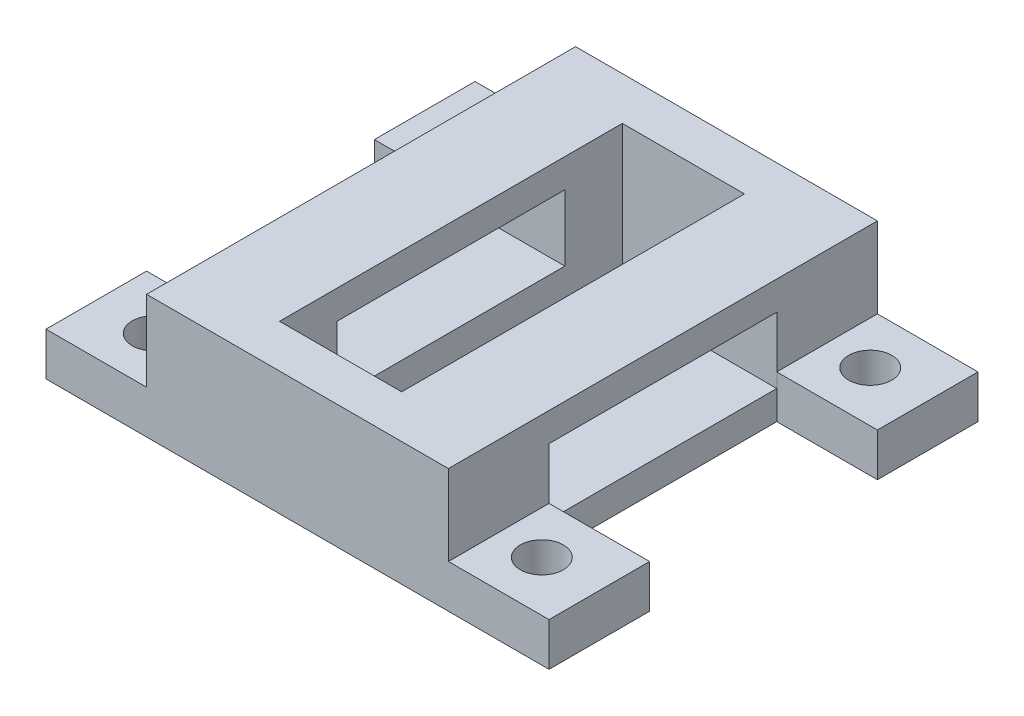
from build123d import *

# Parameters (mm, degrees)
BOSS_EXTRUDE1_DEPTH = 8.6
SKETCH5_W           = 8.5
SKETCH5_H           = 23.85
CUT_EXTRUDE3_DEPTH  = 10
SKETCH6_W           = 15.85
SKETCH6_H           = 4.6
CUT_EXTRUDE4_DEPTH  = 10
SKETCH7_W           = 15.85
SKETCH7_H           = 4.6
CUT_EXTRUDE5_DEPTH  = 10
SKETCH9_W           = 7
SKETCH9_H           = 7
BOSS_EXTRUDE3_DEPTH = 3
SKETCH10_R          = 1.5
CUT_EXTRUDE6_DEPTH  = 3


with BuildPart() as part:
    # Sketch1 → Boss-Extrude1 (new body)
    with BuildSketch(Plane(origin=(0, 0, 0), x_dir=(1, 0, 0), z_dir=(0, 1, 0))):
        Polygon((-10.5, 0), (-10.5, -24.849623113), (-10.5, -29.849623113), (7.5, -29.849623113), (10.5, -29.849623113), (10.5, -24.849623113), (10.5, 0), align=None)
    extrude(amount=BOSS_EXTRUDE1_DEPTH)

    # Sketch5 → Cut-Extrude3 (cut)
    with BuildSketch(Plane(origin=(0, 8.6, 0), x_dir=(1, 0, 0), z_dir=(0, 1, 0))):
        with Locations((0, -14.924623113)):
            Rectangle(SKETCH5_W, SKETCH5_H)
    extrude(amount=-CUT_EXTRUDE3_DEPTH, mode=Mode.SUBTRACT)

    # Sketch6 → Cut-Extrude4 (cut)
    with BuildSketch(Plane.ZY.offset(10.5)):
        with Locations((14.925, 4.3)):
            Rectangle(SKETCH6_W, SKETCH6_H)
    extrude(amount=-CUT_EXTRUDE4_DEPTH, mode=Mode.SUBTRACT)

    # Sketch7 → Cut-Extrude5 (cut)
    with BuildSketch(Plane(origin=(10.5, 0, 0), x_dir=(0, 0, -1), z_dir=(1, 0, 0))):
        with Locations((-14.924623113, 4.3)):
            Rectangle(SKETCH7_W, SKETCH7_H)
    extrude(amount=-CUT_EXTRUDE5_DEPTH, mode=Mode.SUBTRACT)

    # Sketch9 → Boss-Extrude3 (add)
    with BuildSketch(Plane.XZ):
        with Locations((-14, 26.349623113)):
            Rectangle(SKETCH9_W, SKETCH9_H)
        with Locations((14, 26.349623113)):
            Rectangle(SKETCH9_W, SKETCH9_H)
        with Locations((-14, 3.5)):
            Rectangle(SKETCH9_W, SKETCH9_H)
        with Locations((14, 3.5)):
            Rectangle(SKETCH9_W, SKETCH9_H)
    extrude(amount=-BOSS_EXTRUDE3_DEPTH)

    # Sketch10 → Cut-Extrude6 (cut)
    with BuildSketch(Plane(origin=(0, 3, 0), x_dir=(1, 0, 0), z_dir=(0, 1, 0))):
        with Locations(Location((-13.5, -3.5, 0), (0, 0, 270))):
            Circle(SKETCH10_R)
        with Locations(Location((-13.5, -26.349623113, 0), (0, 0, 270))):
            Circle(SKETCH10_R)
        with Locations(Location((13.5, -26.349623113, 0), (0, 0, 90))):
            Circle(SKETCH10_R)
        with Locations(Location((13.5, -3.5, 0), (0, 0, 90))):
            Circle(SKETCH10_R)
    extrude(amount=-CUT_EXTRUDE6_DEPTH, mode=Mode.SUBTRACT)


solid = part.part
